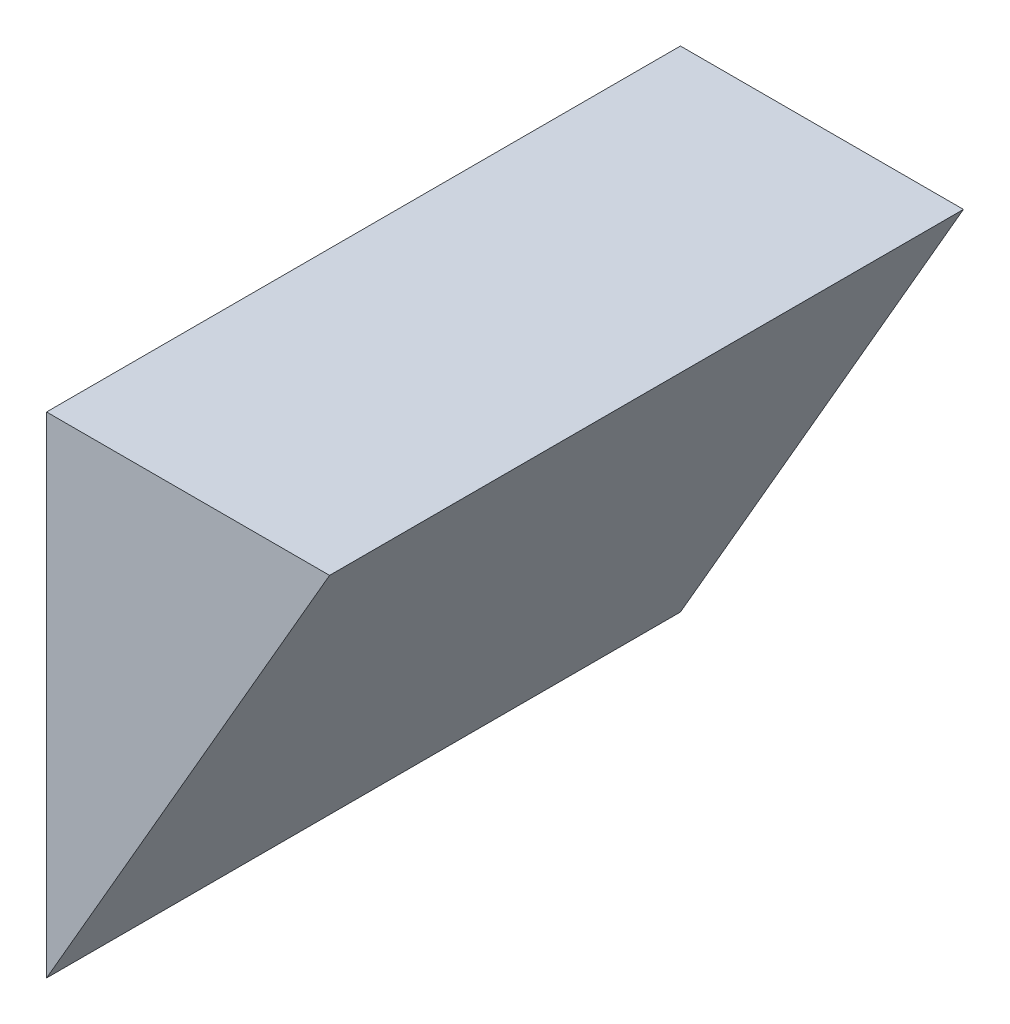
from build123d import *

# Parameters (mm, degrees)
BOSS_EXTRUDE2_DEPTH = 20


with BuildPart() as part:
    # Sketch1 → Boss-Extrude2 (new body)
    with BuildSketch(Plane.XY):
        Polygon((0, 0), (0, -15.467213712), (8.93, 0), align=None)
    extrude(amount=BOSS_EXTRUDE2_DEPTH)


solid = part.part
